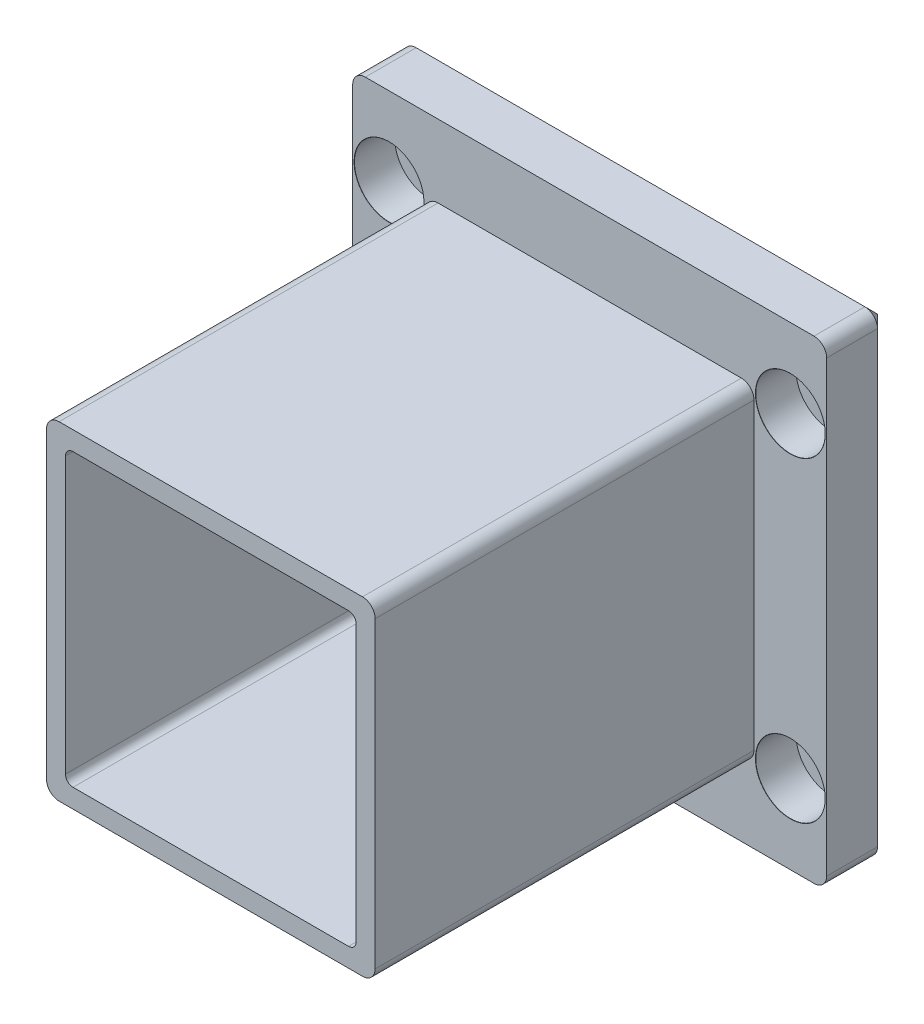
from build123d import *

# Parameters (mm, degrees)
SKETCH1_W                                    = 46
SKETCH1_H                                    = 46
BOSS_EXTRUDE1_DEPTH                          = 65
SKETCH3_W                                    = 75
SKETCH3_H                                    = 75
SKETCH3_W_2                                  = 52
SKETCH3_H_2                                  = 52
SKETCH3_W_3                                  = 23
SKETCH3_H_3                                  = 46
BOSS_EXTRUDE2_DEPTH                          = 5
SKETCH8_W                                    = 75
SKETCH8_H                                    = 75
SKETCH8_W_2                                  = 52
SKETCH8_H_2                                  = 52
BOSS_EXTRUDE3_DEPTH                          = 5.047079132
FILLET1_R                                    = 2
CBORE_FOR_M6_HEX_SOCKET_HEAD_CAP_SCR_2_COUNT = 2
CBORE_FOR_M6_HEX_SOCKET_HEAD_CAP_SCR_2_PITCH = 50
CBORE_FOR_M6_HEX_SOCKET_HEAD_CAP_SCR_3_COUNT = 2
CBORE_FOR_M6_HEX_SOCKET_HEAD_CAP_SCR_3_PITCH = 63.5
CBORE_FOR_M6_HEX_SOCKET_HEAD_CAP_SCR_4_COUNT = 2
CBORE_FOR_M6_HEX_SOCKET_HEAD_CAP_SCR_4_PITCH = 80.822336022
CHAMFER2_SIZE                                = 2
FILLET2_R                                    = 1.2


with BuildPart() as part:
    # Sketch1 → Boss-Extrude1 (new body)
    with BuildSketch(Plane(origin=(0, 0, 0), x_dir=(0, 1, 0), z_dir=(0, 0, 1))):
        Polygon((-26.156583063, 30.146094376), (-29.048003873, 30.146094376), (-29.048003873, -21.853905624), (22.951996127, -21.853905624), (22.951996127, 30.146094376), (15.339697873, 30.146094376), align=None)
        with Locations((-3.048003873, 4.146094376)):
            Rectangle(SKETCH1_W, SKETCH1_H, mode=Mode.SUBTRACT)
    extrude(amount=BOSS_EXTRUDE1_DEPTH)

    # Sketch3 → Boss-Extrude2 (add)
    # profile 1 of 5: a face of its own
    with BuildSketch(Plane(origin=(0, 0, 0), x_dir=(1, 0, 0), z_dir=(0, 0, -1))):
        with Locations((-4.146094376, 3.048003873)):
            Rectangle(SKETCH3_W, SKETCH3_H)
        with Locations((-4.146094376, 3.048003873)):
            Rectangle(SKETCH3_W_2, SKETCH3_H_2, mode=Mode.SUBTRACT)
    # profile 2 of 5: a face of its own
    with BuildSketch(Plane(origin=(0, 0, 0), x_dir=(1, 0, 0), z_dir=(0, 0, -1))):
        Polygon((21.853905624, 29.048003873), (-4.146094376, 29.048003873), (-4.146094376, 26.048003873), (18.853905624, 26.048003873), (18.853905624, -19.951996127), (-4.146094376, -19.951996127), (-4.146094376, -22.951996127), (21.853905624, -22.951996127), align=None)
    # profile 3 of 5: a face of its own
    with BuildSketch(Plane(origin=(0, 0, 0), x_dir=(1, 0, 0), z_dir=(0, 0, -1))):
        Polygon((-4.146094376, 26.048003873), (-4.146094376, 29.048003873), (-30.146094376, 29.048003873), (-30.146094376, -22.951996127), (-4.146094376, -22.951996127), (-4.146094376, -19.951996127), (-27.146094376, -19.951996127), (-27.146094376, 26.048003873), align=None)
    # profile 4 of 5: a face of its own
    with BuildSketch(Plane(origin=(0, 0, 0), x_dir=(1, 0, 0), z_dir=(0, 0, -1))):
        with Locations((7.353905624, 3.048003873)):
            Rectangle(SKETCH3_W_3, SKETCH3_H_3)
    # profile 5 of 5: a face of its own
    with BuildSketch(Plane(origin=(0, 0, 0), x_dir=(1, 0, 0), z_dir=(0, 0, -1))):
        with Locations((-15.646094376, 3.048003873)):
            Rectangle(SKETCH3_W_3, SKETCH3_H_3)
    extrude(amount=BOSS_EXTRUDE2_DEPTH)

    # Sketch8 → Boss-Extrude3 (add)
    with BuildSketch(Plane.XY):
        with Locations((-4.146094376, -3.048003873)):
            Rectangle(SKETCH8_W, SKETCH8_H)
        with Locations((-4.146094376, -3.048003873)):
            Rectangle(SKETCH8_W_2, SKETCH8_H_2, mode=Mode.SUBTRACT)
    extrude(amount=BOSS_EXTRUDE3_DEPTH)

    # Fillet1
    fillet1_edges = [part.edges().sort_by_distance(p)[0] for p in [
        (21.853905624, 22.951996127, 35.023539566),
        (21.853905624, -29.048003873, 35.023539566),
        (-30.146094376, -29.048003873, 35.023539566),
        (-30.146094376, 22.951996127, 35.023539566),
        (-41.646094376, -40.548003873, 0.023539566),
        (33.353905624, -40.548003873, 0.023539566),
        (33.353905624, 34.451996127, 0.023539566),
        (-41.646094376, 34.451996127, 0.023539566),
    ]]
    fillet(fillet1_edges, radius=FILLET1_R)

    # Sketch15 → CBORE for M6 Hex Socket Head Cap Screw2 (revolve, cut)
    with BuildSketch(Plane(origin=(-35.896094376, 21.951996127, 5.047079132), x_dir=(0, -1, 0), z_dir=(1, 0, 0))):
        Polygon((0, 0), (0, 10.047079132), (3.3, 10.047079132), (3.3, 6.4), (5.5, 6.4), (5.5, 0.025), (5.525, 0), align=None)
    cbore_for_m6_hex_socket_head_cap_screw2 = revolve(axis=Axis((-35.896094376, 21.951996127, 11.397079132), (0, 0, -1)), mode=Mode.SUBTRACT)

    # CBORE for M6 Hex Socket Head Cap Scr 2: CBORE for M6 Hex Socket Head Cap Screw2 ×2
    with Locations(*[(0, -i * CBORE_FOR_M6_HEX_SOCKET_HEAD_CAP_SCR_2_PITCH, 0) for i in range(1, CBORE_FOR_M6_HEX_SOCKET_HEAD_CAP_SCR_2_COUNT)]):
        add(cbore_for_m6_hex_socket_head_cap_screw2, mode=Mode.SUBTRACT)

    # CBORE for M6 Hex Socket Head Cap Scr 3: CBORE for M6 Hex Socket Head Cap Screw2 ×2
    with Locations(*[(i * CBORE_FOR_M6_HEX_SOCKET_HEAD_CAP_SCR_3_PITCH, 0, 0) for i in range(1, CBORE_FOR_M6_HEX_SOCKET_HEAD_CAP_SCR_3_COUNT)]):
        add(cbore_for_m6_hex_socket_head_cap_screw2, mode=Mode.SUBTRACT)

    # CBORE for M6 Hex Socket Head Cap Scr 4: CBORE for M6 Hex Socket Head Cap Screw2 ×2
    with Locations(*[Vector(0.7856739006278309, -0.6186408666360874, 0) * (i * CBORE_FOR_M6_HEX_SOCKET_HEAD_CAP_SCR_4_PITCH) for i in range(1, CBORE_FOR_M6_HEX_SOCKET_HEAD_CAP_SCR_4_COUNT)]):
        add(cbore_for_m6_hex_socket_head_cap_screw2, mode=Mode.SUBTRACT)

    # Chamfer2
    chamfer2_edges = [part.edges().sort_by_distance(p)[0] for p in [
        (33.353905624, -3.048003873, -5),
        (-4.146094376, 34.451996127, -5),
        (-4.146094376, -40.548003873, -5),
        (-41.646094376, -3.048003873, -5),
        (32.768119187, -39.962217436, -5),
        (-41.060307938, -39.962217436, -5),
        (-41.060307938, 33.866209689, -5),
        (32.768119187, 33.866209689, -5),
    ]]
    chamfer(chamfer2_edges, length=CHAMFER2_SIZE)

    # Fillet2
    fillet2_edges = [part.edges().sort_by_distance(p)[0] for p in [
        (18.853905624, -26.048003873, 32.5),
        (18.853905624, 19.951996127, 32.5),
        (-27.146094376, 19.951996127, 32.5),
        (-27.146094376, -26.048003873, 32.5),
    ]]
    fillet(fillet2_edges, radius=FILLET2_R)


solid = part.part
